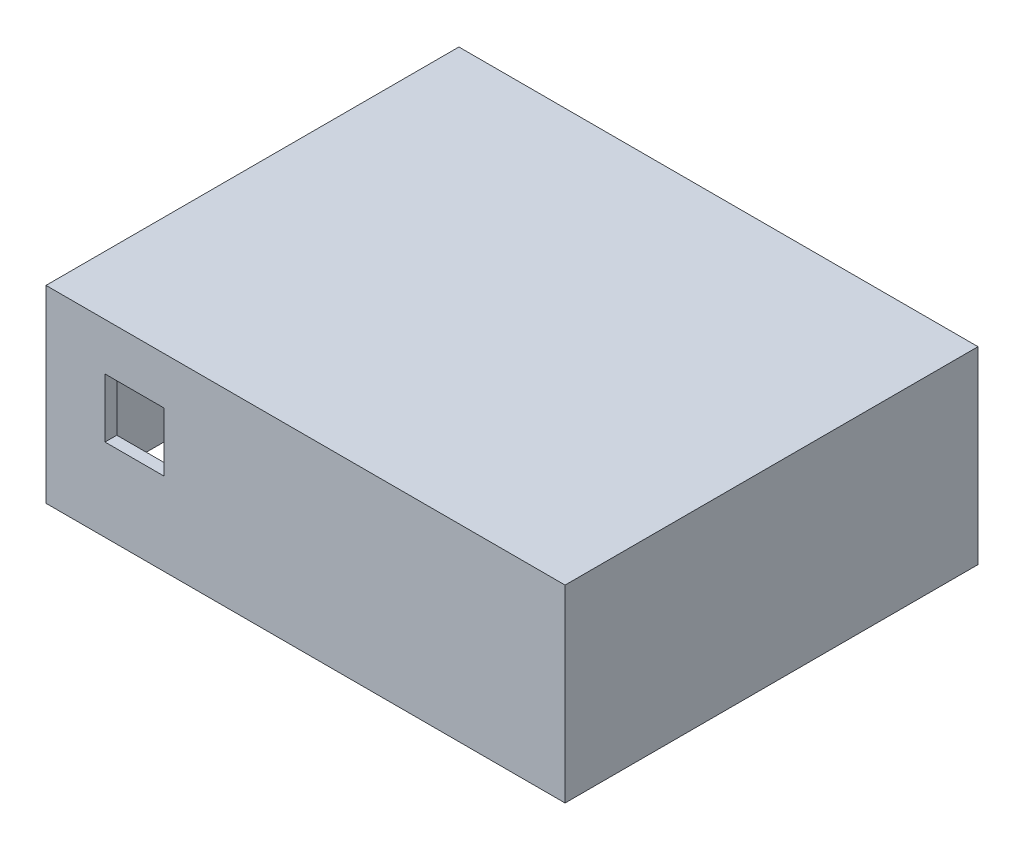
from build123d import *

# Parameters (mm, degrees)
SKETCH1_W                 = 88
SKETCH1_H                 = 70
BOSS_EXTRUDE1_DEPTH       = 32
SKETCH2_W                 = 84
SKETCH2_H                 = 66
CUT_EXTRUDE1_DEPTH        = 30
SKETCH4_W                 = 10
SKETCH4_H                 = 16.5
CUT_EXTRUDE2_DEPTH        = 3
SKETCH6_W                 = 10
SKETCH6_H                 = 10
CUT_EXTRUDE3_DEPTH        = 3
SKETCH7_W                 = 86
SKETCH7_H                 = 68
CUT_EXTRUDE4_DEPTH        = 1
SKETCH10_W                = 25
SKETCH10_H                = 6.5
SKETCH10_W_2              = 6
SKETCH10_H_2              = 6
CUT_EXTRUDE5_DEPTH        = 3
BOSS_EXTRUDE2_DEPTH       = 30
F_2_0MM_DOWEL_HOLE1_D     = 1.5
F_2_0MM_DOWEL_HOLE1_DEPTH = 2.749354536
F_2_0MM_DOWEL_HOLE1_TIP   = 0.450645464
CUT_EXTRUDE6_DEPTH        = 3


with BuildPart() as part:
    # Sketch1 → Boss-Extrude1 (new body)
    with BuildSketch(Plane(origin=(0, 0, 0), x_dir=(1, 0, 0), z_dir=(0, 1, 0))):
        Rectangle(SKETCH1_W, SKETCH1_H)
    extrude(amount=BOSS_EXTRUDE1_DEPTH)

    # Sketch2 → Cut-Extrude1 (cut)
    with BuildSketch(Plane(origin=(0, 0, 0), x_dir=(1, 0, 0), z_dir=(0, 1, 0))):
        Rectangle(SKETCH2_W, SKETCH2_H)
    extrude(amount=CUT_EXTRUDE1_DEPTH, mode=Mode.SUBTRACT)

    # Sketch4 → Cut-Extrude2 (cut)
    with BuildSketch(Plane(origin=(0, 0, -35), x_dir=(-1, 0, 0), z_dir=(0, 0, -1))):
        with Locations((19, 17.25)):
            Rectangle(SKETCH4_W, SKETCH4_H)
    extrude(amount=-CUT_EXTRUDE2_DEPTH, mode=Mode.SUBTRACT)

    # Sketch6 → Cut-Extrude3 (cut)
    with BuildSketch(Plane.XY.offset(35)):
        with Locations((-29, 19)):
            Rectangle(SKETCH6_W, SKETCH6_H)
    extrude(amount=-CUT_EXTRUDE3_DEPTH, mode=Mode.SUBTRACT)

    # Sketch7 → Cut-Extrude4 (cut)
    with BuildSketch(Plane.XZ):
        Rectangle(SKETCH7_W, SKETCH7_H)
    extrude(amount=-CUT_EXTRUDE4_DEPTH, mode=Mode.SUBTRACT)

    # Sketch10 → Cut-Extrude5 (cut)
    with BuildSketch(Plane(origin=(0, 0, -35), x_dir=(-1, 0, 0), z_dir=(0, 0, -1))):
        with Locations((-26.5, 25.25)):
            Rectangle(SKETCH10_W, SKETCH10_H)
        with Locations((-13, 4.5)):
            Rectangle(SKETCH10_W_2, SKETCH10_H_2)
    extrude(amount=-CUT_EXTRUDE5_DEPTH, mode=Mode.SUBTRACT)

    # Sketch11 → Boss-Extrude2 (add)
    with BuildSketch(Plane.XZ.offset(-30)):
        with BuildLine():
            Line((38, 33), (42, 33))
            Line((42, 33), (42, 29))
            ThreePointArc((42, 29), (39.171572875, 30.171572875), (38, 33))
        make_face()
        with BuildLine():
            Line((-42, 33), (-42, 29))
            ThreePointArc((-42, 29), (-39.171572875, 30.171572875), (-38, 33))
            Line((-38, 33), (-42, 33))
        make_face()
        with BuildLine():
            Line((42, -29.5), (42, -33))
            Line((42, -33), (38.5, -33))
            ThreePointArc((38.5, -33), (39.525126266, -30.525126266), (42, -29.5))
        make_face()
        with BuildLine():
            Line((-35.5, -33), (-27.5, -33))
            ThreePointArc((-27.5, -33), (-31.5, -29), (-35.5, -33))
        make_face()
    extrude(amount=BOSS_EXTRUDE2_DEPTH)

    # Ø2.0mm Dowel Hole1
    with Locations(Plane(origin=(0, 0, 0), x_dir=(-1, 0, 0), z_dir=(0, -1, 0))):
        with Locations((-41, 31), (31.5, 31), (40.267949192, -32), (-40, -32)):
            Hole(F_2_0MM_DOWEL_HOLE1_D / 2, depth=F_2_0MM_DOWEL_HOLE1_DEPTH)
            with Locations((0, 0, -(F_2_0MM_DOWEL_HOLE1_DEPTH + F_2_0MM_DOWEL_HOLE1_TIP / 2))):  # 118° drill point
                Cone(0, F_2_0MM_DOWEL_HOLE1_D / 2, F_2_0MM_DOWEL_HOLE1_TIP, mode=Mode.SUBTRACT)

    # Sketch22 → Cut-Extrude6 (cut)
    with BuildSketch(Plane(origin=(0, 0, -35), x_dir=(-1, 0, 0), z_dir=(0, 0, -1))):
        with BuildLine():
            Line((37.9, 24.08), (37.9, 18.3))
            ThreePointArc((37.9, 18.3), (39.18, 17.02), (40.46, 18.3))
            Line((40.46, 18.3), (40.46, 24.08))
            ThreePointArc((40.46, 24.08), (39.18, 25.36), (37.9, 24.08))
        make_face()
    extrude(amount=-CUT_EXTRUDE6_DEPTH, mode=Mode.SUBTRACT)


solid = part.part
